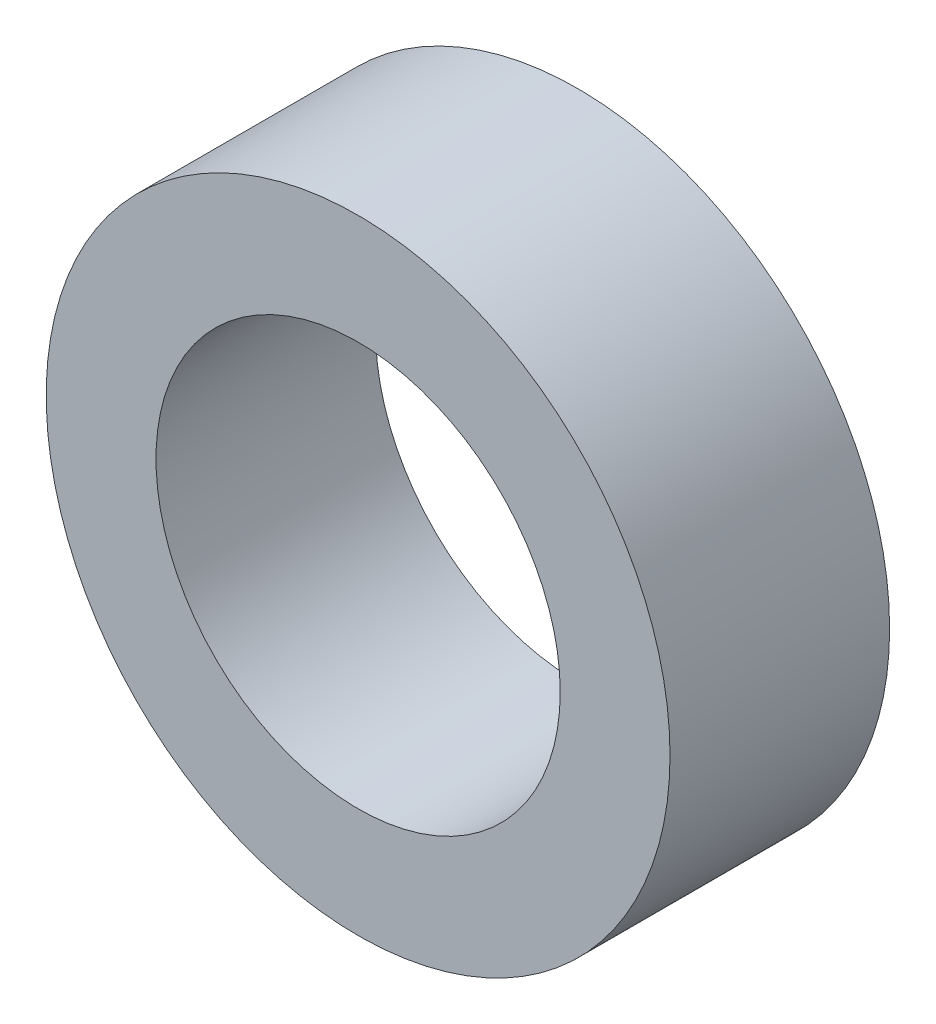
from build123d import *

# Parameters (mm, degrees)
SKETCH1_R           = 7.9375
SKETCH1_R_2         = 5.1435
BOSS_EXTRUDE1_DEPTH = 5.588


with BuildPart() as part:
    # Sketch1 → Boss-Extrude1 (new body)
    with BuildSketch(Plane.XY):
        Circle(SKETCH1_R)
        Circle(SKETCH1_R_2, mode=Mode.SUBTRACT)
    extrude(amount=BOSS_EXTRUDE1_DEPTH)


solid = part.part
